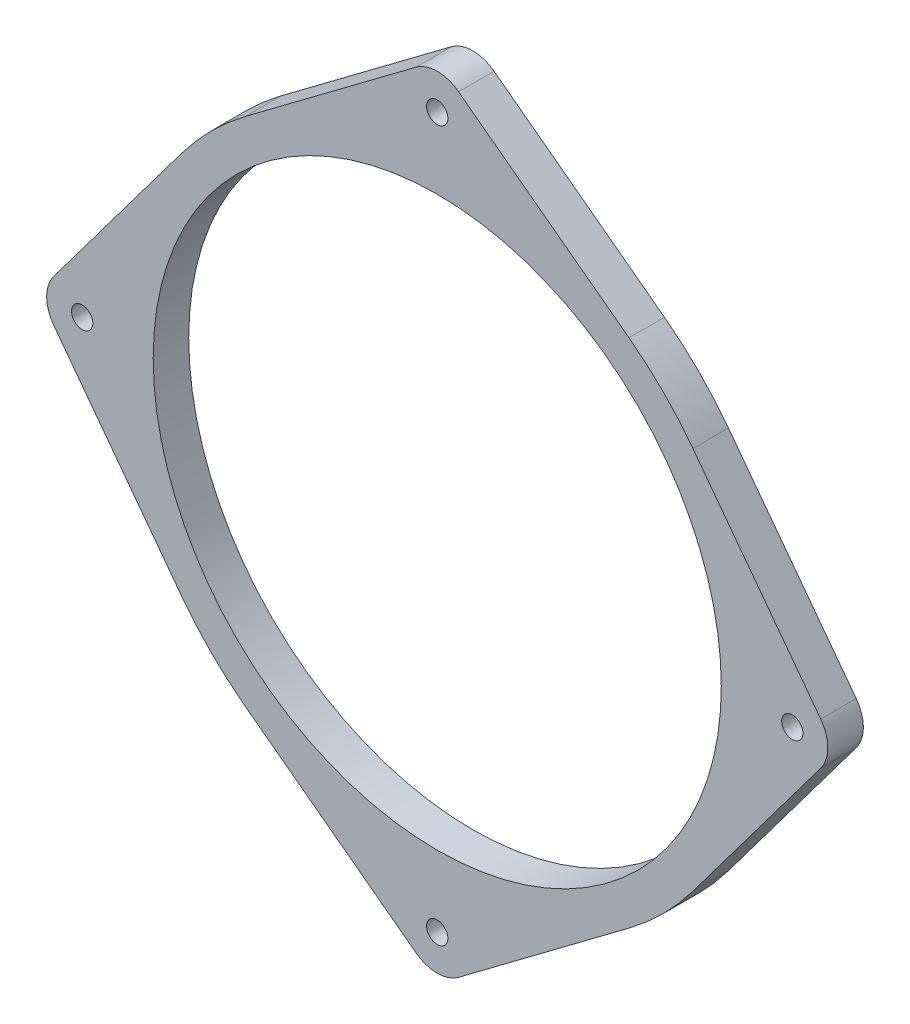
from build123d import *

# Parameters (mm, degrees)
ESQUISSE1_R        = 1.5
BOSS_EXTRU_2_DEPTH = 5


with BuildPart() as part:
    # Esquisse1 → Boss.-Extru.2 (new body)
    # profile 1 of 10: a face of its own
    with BuildSketch(Plane.XY):
        with BuildLine():
            ThreePointArc((-40, 0), (0, 40), (40, 0))
            Line((40, 0), (45, 0))
            ThreePointArc((45, 0), (42.690748412, 14.230249471), (36, 27))
            ThreePointArc((36, 27), (31.819805153, 31.819805153), (27, 36))
            ThreePointArc((27, 36), (0, 45), (-27, 36))
            ThreePointArc((-27, 36), (-31.819805153, 31.819805153), (-36, 27))
            ThreePointArc((-36, 27), (-42.690748412, 14.230249471), (-45, 0))
            Line((-45, 0), (-40, 0))
        make_face()
    # profile 2 of 10: a face of its own
    with BuildSketch(Plane.XY):
        with BuildLine():
            Line((45, 0), (40, 0))
            ThreePointArc((40, 0), (0, -40), (-40, 0))
            Line((-40, 0), (-45, 0))
            ThreePointArc((-45, 0), (-42.690748412, -14.230249471), (-36, -27))
            ThreePointArc((-36, -27), (-31.819805153, -31.819805153), (-27, -36))
            ThreePointArc((-27, -36), (0, -45), (27, -36))
            ThreePointArc((27, -36), (31.819805153, -31.819805153), (36, -27))
            ThreePointArc((36, -27), (42.690748412, -14.230249471), (45, 0))
        make_face()
    # profile 3 of 10: a face of its own
    with BuildSketch(Plane.XY):
        with BuildLine():
            ThreePointArc((-40, 0), (0, 40), (40, 0))
            Line((40, 0), (45, 0))
            ThreePointArc((45, 0), (42.690748412, 14.230249471), (36, 27))
            ThreePointArc((36, 27), (31.819805153, 31.819805153), (27, 36))
            ThreePointArc((27, 36), (0, 45), (-27, 36))
            ThreePointArc((-27, 36), (-31.819805153, 31.819805153), (-36, 27))
            ThreePointArc((-36, 27), (-42.690748412, 14.230249471), (-45, 0))
            Line((-45, 0), (-40, 0))
        make_face()
    # profile 4 of 10: a face of its own
    with BuildSketch(Plane.XY):
        with BuildLine():
            Line((45, 0), (40, 0))
            ThreePointArc((40, 0), (0, -40), (-40, 0))
            Line((-40, 0), (-45, 0))
            ThreePointArc((-45, 0), (-42.690748412, -14.230249471), (-36, -27))
            ThreePointArc((-36, -27), (-31.819805153, -31.819805153), (-27, -36))
            ThreePointArc((-27, -36), (0, -45), (27, -36))
            ThreePointArc((27, -36), (31.819805153, -31.819805153), (36, -27))
            ThreePointArc((36, -27), (42.690748412, -14.230249471), (45, 0))
        make_face()
    # profile 5 of 10: a face of its own
    with BuildSketch(Plane.XY):
        with BuildLine():
            ThreePointArc((-27, 36), (0, 45), (27, 36))
            Line((27, 36), (3, 54))
            ThreePointArc((3, 54), (0, 55), (-3, 54))
            Line((-3, 54), (-27, 36))
        make_face()
        with Locations((0, 50)):
            Circle(ESQUISSE1_R, mode=Mode.SUBTRACT)
    # profile 6 of 10: a face of its own
    with BuildSketch(Plane.XY):
        with BuildLine():
            Line((48.5, 0), (45, 0))
            ThreePointArc((45, 0), (42.690748412, -14.230249471), (36, -27))
            Line((36, -27), (54, -3))
            ThreePointArc((54, -3), (54.74341649, -1.58113883), (55, 0))
            Line((55, 0), (51.5, 0))
            ThreePointArc((51.5, 0), (50, -1.5), (48.5, 0))
        make_face()
    # profile 7 of 10: a face of its own
    with BuildSketch(Plane.XY):
        with BuildLine():
            ThreePointArc((36, 27), (42.690748412, 14.230249471), (45, 0))
            Line((45, 0), (48.5, 0))
            ThreePointArc((48.5, 0), (50, 1.5), (51.5, 0))
            Line((51.5, 0), (55, 0))
            ThreePointArc((55, 0), (54.74341649, 1.58113883), (54, 3))
            Line((54, 3), (36, 27))
        make_face()
    # profile 8 of 10: a face of its own
    with BuildSketch(Plane.XY):
        with BuildLine():
            Line((3, -54), (27, -36))
            ThreePointArc((27, -36), (0, -45), (-27, -36))
            Line((-27, -36), (-3, -54))
            ThreePointArc((-3, -54), (0, -55), (3, -54))
        make_face()
        with Locations((0, -50)):
            Circle(ESQUISSE1_R, mode=Mode.SUBTRACT)
    # profile 9 of 10: a face of its own
    with BuildSketch(Plane.XY):
        with BuildLine():
            Line((-48.5, 0), (-45, 0))
            ThreePointArc((-45, 0), (-42.690748412, 14.230249471), (-36, 27))
            Line((-36, 27), (-54, 3))
            ThreePointArc((-54, 3), (-54.74341649, 1.58113883), (-55, 0))
            Line((-55, 0), (-51.5, 0))
            ThreePointArc((-51.5, 0), (-50, 1.5), (-48.5, 0))
        make_face()
    # profile 10 of 10: a face of its own
    with BuildSketch(Plane.XY):
        with BuildLine():
            ThreePointArc((-36, -27), (-42.690748412, -14.230249471), (-45, 0))
            Line((-45, 0), (-48.5, 0))
            ThreePointArc((-48.5, 0), (-50, -1.5), (-51.5, 0))
            Line((-51.5, 0), (-55, 0))
            ThreePointArc((-55, 0), (-54.74341649, -1.58113883), (-54, -3))
            Line((-54, -3), (-36, -27))
        make_face()
    extrude(amount=BOSS_EXTRU_2_DEPTH)


solid = part.part
